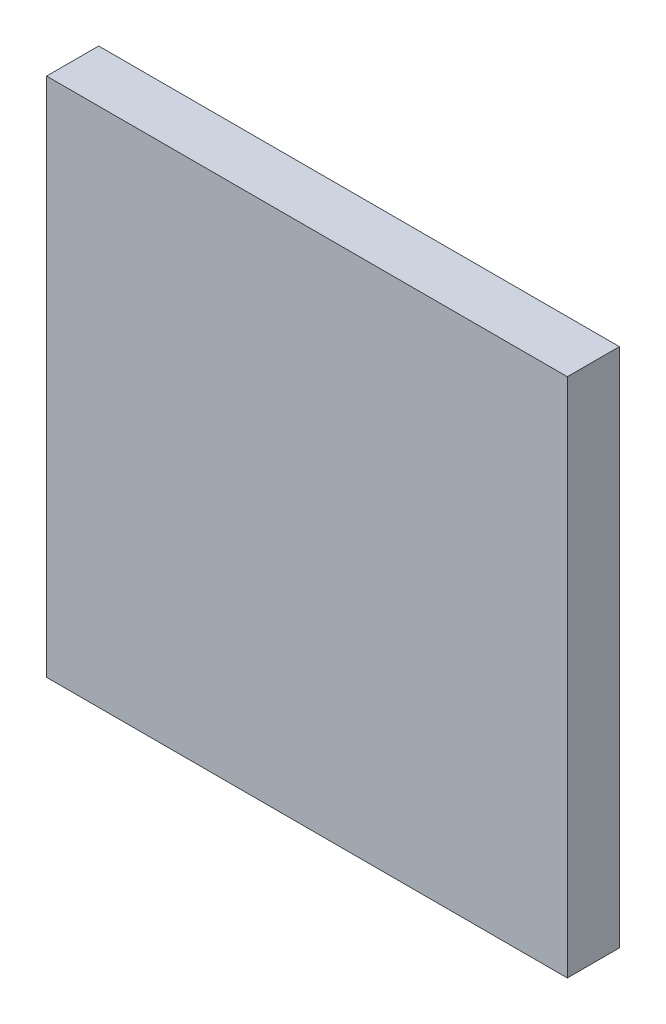
from build123d import *

# Parameters (mm, degrees)
SKETCH1_W           = 10
SKETCH1_H           = 10
BOSS_EXTRUDE1_DEPTH = 1


with BuildPart() as part:
    # Sketch1 → Boss-Extrude1 (new body)
    with BuildSketch(Plane.XY):
        Rectangle(SKETCH1_W, SKETCH1_H)
    extrude(amount=BOSS_EXTRUDE1_DEPTH)


solid = part.part
